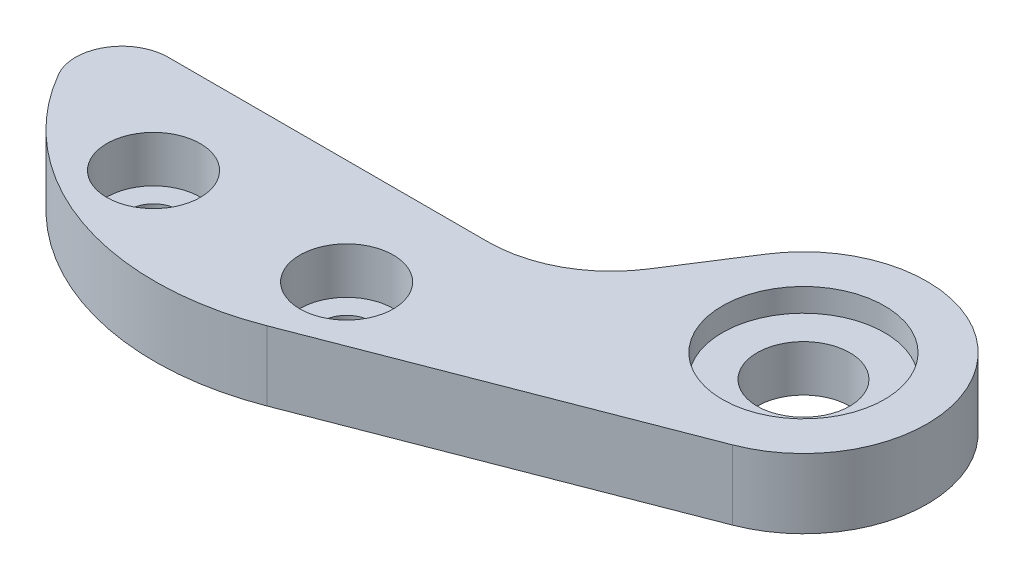
from build123d import *

# Parameters (mm, degrees)
EXTRUDE_1_DEPTH             = 4.5
HOLE_WIZARD_M31_D           = 3.2
HOLE_WIZARD_M31_CBORE_D     = 6.05
HOLE_WIZARD_M31_CBORE_DEPTH = 3
HOLE_WIZARD_1_D             = 6
HOLE_WIZARD_1_CBORE_D       = 10.5
HOLE_WIZARD_1_CBORE_DEPTH   = 1.5
FILLET_1_R                  = 8


with BuildPart() as part:
    # Эскиз1 → Бобышка-Вытянуть1 (new body)
    with BuildSketch(Plane.XZ):
        with BuildLine():
            Line((-12.124355653, 4), (12.936430666, 4))
            Line((12.936430666, 4), (18.263831879, -4.315557791))
            ThreePointArc((18.263831879, -4.315557791), (31.197157109, -5.059174218), (27.88, 7.463618425))
            Line((27.88, 7.463618425), (6.12, 15.860189154))
            ThreePointArc((6.12, 15.860189154), (-5.660702659, 16.029861054), (-14.722431864, 8.5))
            ThreePointArc((-14.722431864, 8.5), (-14.722431864, 5.5), (-12.124355653, 4))
        make_face()
    extrude(amount=-EXTRUDE_1_DEPTH)

    # Цековка для винта с заклепочной головкой M31 (through all)
    with Locations(Plane(origin=(0, 4.5, 0), x_dir=(1, 0, 0), z_dir=(0, 1, 0))):
        with Locations((-6.25, -10.825317547), (6.25, -10.825317547)):
            CounterBoreHole(HOLE_WIZARD_M31_D / 2, HOLE_WIZARD_M31_CBORE_D / 2, HOLE_WIZARD_M31_CBORE_DEPTH)

    # Отверстие1 (through all)
    with Locations(Plane(origin=(0, 4.5, 0), x_dir=(1, 0, 0), z_dir=(0, 1, 0))):
        with Locations((25, 0)):
            CounterBoreHole(HOLE_WIZARD_1_D / 2, HOLE_WIZARD_1_CBORE_D / 2, HOLE_WIZARD_1_CBORE_DEPTH)

    # Скругление1
    fillet_1_edges = [part.edges().sort_by_distance(p)[0] for p in [
        (12.936430666, 2.25, 4),
    ]]
    fillet(fillet_1_edges, radius=FILLET_1_R)


solid = part.part
